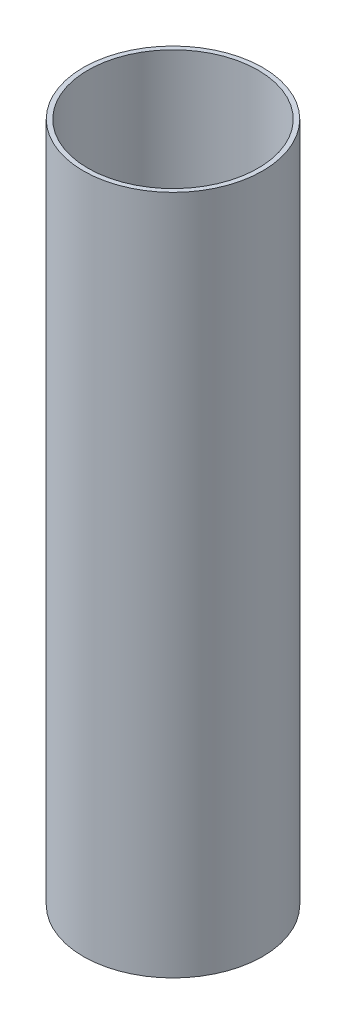
from build123d import *

# Parameters (mm, degrees)
SKETCH1_R           = 40.1574
SKETCH1_R_2         = 38.1
BOSS_EXTRUDE1_DEPTH = 304.8


with BuildPart() as part:
    # Sketch1 → Boss-Extrude1 (new body)
    with BuildSketch(Plane(origin=(0, 0, 0), x_dir=(1, 0, 0), z_dir=(0, 1, 0))):
        with Locations(Location((0, 0, 0), (0, 0, 270))):
            Circle(SKETCH1_R)
        with Locations(Location((0, 0, 0), (0, 0, 270))):
            Circle(SKETCH1_R_2, mode=Mode.SUBTRACT)
    extrude(amount=-BOSS_EXTRUDE1_DEPTH)


solid = part.part
